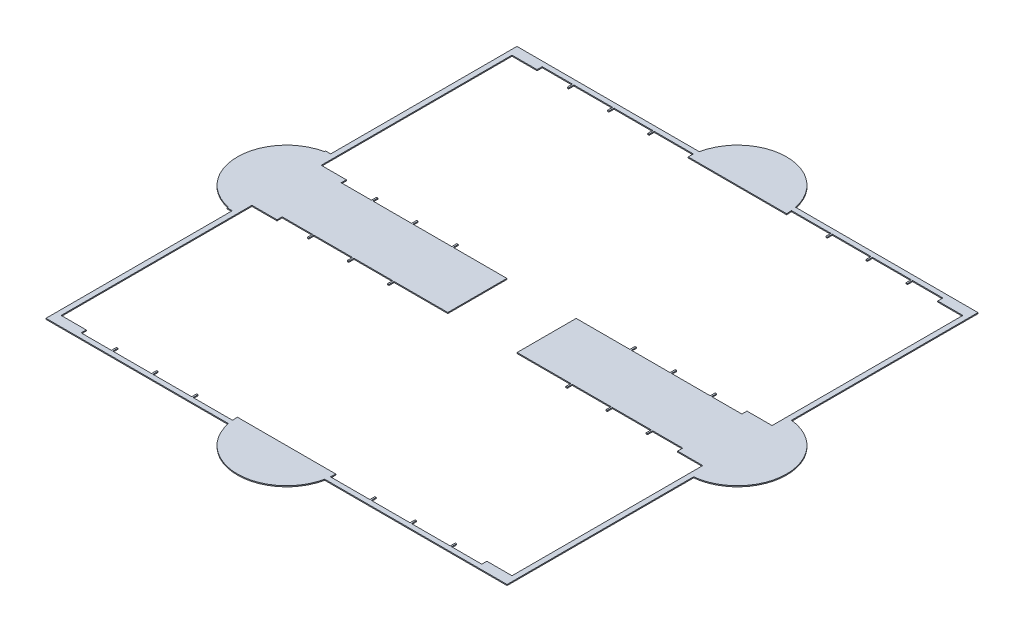
from build123d import *

# Parameters (mm, degrees)
SKETCH1_W           = 22.96
SKETCH1_H           = 22.96
SKETCH1_W_2         = 22.45
SKETCH1_H_2         = 22.45
SKETCH1_W_3         = 9.5
SKETCH1_H_3         = 0.255
SKETCH1_W_4         = 3.45
SKETCH1_H_4         = 3.45
SKETCH1_R           = 0.975
SKETCH1_W_5         = 0.25
SKETCH1_H_5         = 1
BOSS_EXTRUDE5_DEPTH = 0.05
SKETCH2_W           = 0.07
SKETCH2_H           = 0.5
CUT_EXTRUDE1_DEPTH  = 10
CUT_EXTRUDE3_START  = -10
SKETCH3_R           = 0.975
SKETCH3_W           = 0.561213406
SKETCH3_H           = 2.94
SKETCH3_W_2         = 2.113786594
SKETCH3_H_2         = 0.255
CUT_EXTRUDE3_DEPTH  = 10
BOSS_EXTRUDE7_DEPTH = 0.05


with BuildPart() as part:
    # Sketch1 → Boss-Extrude5 (new body)
    # profile 1 of 8: a face of its own
    with BuildSketch(Plane(origin=(0, 0, 0), x_dir=(1, 0, 0), z_dir=(0, 1, 0))):
        Rectangle(SKETCH1_W, SKETCH1_H)
        Rectangle(SKETCH1_W_2, SKETCH1_H_2, mode=Mode.SUBTRACT)
    # profile 2 of 8: a face of its own
    with BuildSketch(Plane(origin=(0, 0, 0), x_dir=(1, 0, 0), z_dir=(0, 1, 0))):
        with Locations((-6.475, -1.5975)):
            Rectangle(SKETCH1_W_3, SKETCH1_H_3)
    # profile 3 of 8: a face of its own
    with BuildSketch(Plane(origin=(0, 0, 0), x_dir=(1, 0, 0), z_dir=(0, 1, 0))):
        with Locations((-6.475, 1.5975)):
            Rectangle(SKETCH1_W_3, SKETCH1_H_3)
    # profile 4 of 8: a face of its own
    with BuildSketch(Plane(origin=(0, 0, 0), x_dir=(1, 0, 0), z_dir=(0, 1, 0))):
        Rectangle(SKETCH1_W_4, SKETCH1_H_4)
        with Locations(Location((0, 0, 0), (0, 0, 270))):
            Circle(SKETCH1_R, mode=Mode.SUBTRACT)
    # profile 5 of 8: a face of its own
    with BuildSketch(Plane(origin=(0, 0, 0), x_dir=(1, 0, 0), z_dir=(0, 1, 0))):
        with Locations((6.475, 1.5975)):
            Rectangle(SKETCH1_W_3, SKETCH1_H_3)
    # profile 6 of 8: a face of its own
    with BuildSketch(Plane(origin=(0, 0, 0), x_dir=(1, 0, 0), z_dir=(0, 1, 0))):
        with Locations((6.475, -1.5975)):
            Rectangle(SKETCH1_W_3, SKETCH1_H_3)
    # profile 7 of 8: a face of its own
    with BuildSketch(Plane(origin=(0, 0, 0), x_dir=(1, 0, 0), z_dir=(0, 1, 0))):
        with Locations((-11.605, -1.95)):
            Rectangle(SKETCH1_W_5, SKETCH1_H_5)
    # profile 8 of 8: a face of its own
    with BuildSketch(Plane(origin=(0, 0, 0), x_dir=(1, 0, 0), z_dir=(0, 1, 0))):
        with Locations((-11.605, 1.95)):
            Rectangle(SKETCH1_W_5, SKETCH1_H_5)
    extrude(amount=BOSS_EXTRUDE5_DEPTH)

    # Sketch2 → Cut-Extrude1 (cut)
    with BuildSketch(Plane(origin=(0, 0.05, 0), x_dir=(1, 0, 0), z_dir=(0, 1, 0))):
        with Locations((-6.435, 1.475)):
            Rectangle(SKETCH2_W, SKETCH2_H)
        with Locations((-8.435, 1.475)):
            Rectangle(SKETCH2_W, SKETCH2_H)
        with Locations((-4.435, 1.475)):
            Rectangle(SKETCH2_W, SKETCH2_H)
        with Locations((-4.435, 11.475)):
            Rectangle(SKETCH2_W, SKETCH2_H)
        with Locations((-6.435, 11.475)):
            Rectangle(SKETCH2_W, SKETCH2_H)
        with Locations((-8.435, 11.475)):
            Rectangle(SKETCH2_W, SKETCH2_H)
        with Locations((4.435, 1.475)):
            Rectangle(SKETCH2_W, SKETCH2_H)
        with Locations((6.435, 1.475)):
            Rectangle(SKETCH2_W, SKETCH2_H)
        with Locations((8.435, 1.475)):
            Rectangle(SKETCH2_W, SKETCH2_H)
        with Locations((4.435, 11.475)):
            Rectangle(SKETCH2_W, SKETCH2_H)
        with Locations((6.435, 11.475)):
            Rectangle(SKETCH2_W, SKETCH2_H)
        with Locations((8.435, 11.475)):
            Rectangle(SKETCH2_W, SKETCH2_H)
        with Locations((-8.435, -11.475)):
            Rectangle(SKETCH2_W, SKETCH2_H)
        with Locations((-6.435, -11.475)):
            Rectangle(SKETCH2_W, SKETCH2_H)
        with Locations((-4.435, -11.475)):
            Rectangle(SKETCH2_W, SKETCH2_H)
        with Locations((4.435, -11.475)):
            Rectangle(SKETCH2_W, SKETCH2_H)
        with Locations((6.435, -11.475)):
            Rectangle(SKETCH2_W, SKETCH2_H)
        with Locations((8.435, -11.475)):
            Rectangle(SKETCH2_W, SKETCH2_H)
        with Locations((8.435, -1.475)):
            Rectangle(SKETCH2_W, SKETCH2_H)
        with Locations((6.435, -1.475)):
            Rectangle(SKETCH2_W, SKETCH2_H)
        with Locations((4.435, -1.475)):
            Rectangle(SKETCH2_W, SKETCH2_H)
        with Locations((-4.435, -1.475)):
            Rectangle(SKETCH2_W, SKETCH2_H)
        with Locations((-6.435, -1.475)):
            Rectangle(SKETCH2_W, SKETCH2_H)
        with Locations((-8.435, -1.475)):
            Rectangle(SKETCH2_W, SKETCH2_H)
    extrude(amount=-CUT_EXTRUDE1_DEPTH, mode=Mode.SUBTRACT)

    # Sketch3 → Cut-Extrude3 (cut)
    # profile 1 of 9: a face of its own
    with BuildSketch(Plane(origin=(0, 0.05, 0), x_dir=(1, 0, 0), z_dir=(0, 1, 0)).offset(CUT_EXTRUDE3_START)):
        Polygon((-9.975, 11.48), (-9.975, -11.48), (-2.286213406, -11.48), (-2.286213406, -1.725), (-4.4, -1.725), (-4.4, -1.47), (-2.286213406, -1.47), (-2.286213406, 1.47), (-4.4, 1.47), (-4.4, 1.725), (-2.286213406, 1.725), (-2.286213406, 11.48), align=None)
    # profile 2 of 9: a face of its own
    with BuildSketch(Plane(origin=(0, 0.05, 0), x_dir=(1, 0, 0), z_dir=(0, 1, 0)).offset(CUT_EXTRUDE3_START)):
        Polygon((-2.286213406, -1.47), (-2.286213406, -1.725), (0, -1.725), (2.286213406, -1.725), (2.286213406, -1.47), (1.725, -1.47), (1.725, 1.47), (2.286213406, 1.47), (2.286213406, 1.725), (0, 1.725), (-2.286213406, 1.725), (-2.286213406, 1.47), (-1.725, 1.47), (-1.725, -1.47), align=None)
        Circle(SKETCH3_R, mode=Mode.SUBTRACT)
    # profile 3 of 9: a face of its own
    with BuildSketch(Plane(origin=(0, 0.05, 0), x_dir=(1, 0, 0), z_dir=(0, 1, 0)).offset(CUT_EXTRUDE3_START)):
        Polygon((2.286213406, -1.725), (2.286213406, -11.48), (9.975, -11.48), (9.975, 11.48), (2.286213406, 11.48), (2.286213406, 1.725), (4.4, 1.725), (4.4, 1.47), (2.286213406, 1.47), (2.286213406, -1.47), (4.4, -1.47), (4.4, -1.725), align=None)
    # profile 4 of 9: a face of its own
    with BuildSketch(Plane(origin=(0, 0.05, 0), x_dir=(1, 0, 0), z_dir=(0, 1, 0)).offset(CUT_EXTRUDE3_START)):
        with Locations((2.005606703, 0)):
            Rectangle(SKETCH3_W, SKETCH3_H)
    # profile 5 of 9: a face of its own
    with BuildSketch(Plane(origin=(0, 0.05, 0), x_dir=(1, 0, 0), z_dir=(0, 1, 0)).offset(CUT_EXTRUDE3_START)):
        with Locations((-2.005606703, 0)):
            Rectangle(SKETCH3_W, SKETCH3_H)
    # profile 6 of 9: a face of its own
    with BuildSketch(Plane(origin=(0, 0.05, 0), x_dir=(1, 0, 0), z_dir=(0, 1, 0)).offset(CUT_EXTRUDE3_START)):
        with Locations((-3.343106703, 1.5975)):
            Rectangle(SKETCH3_W_2, SKETCH3_H_2)
    # profile 7 of 9: a face of its own
    with BuildSketch(Plane(origin=(0, 0.05, 0), x_dir=(1, 0, 0), z_dir=(0, 1, 0)).offset(CUT_EXTRUDE3_START)):
        with Locations((-3.343106703, -1.5975)):
            Rectangle(SKETCH3_W_2, SKETCH3_H_2)
    # profile 8 of 9: a face of its own
    with BuildSketch(Plane(origin=(0, 0.05, 0), x_dir=(1, 0, 0), z_dir=(0, 1, 0)).offset(CUT_EXTRUDE3_START)):
        with Locations((3.343106703, 1.5975)):
            Rectangle(SKETCH3_W_2, SKETCH3_H_2)
    # profile 9 of 9: a face of its own
    with BuildSketch(Plane(origin=(0, 0.05, 0), x_dir=(1, 0, 0), z_dir=(0, 1, 0)).offset(CUT_EXTRUDE3_START)):
        with Locations((3.343106703, -1.5975)):
            Rectangle(SKETCH3_W_2, SKETCH3_H_2)
    extrude(amount=CUT_EXTRUDE3_DEPTH, mode=Mode.SUBTRACT)

    # Sketch5 → Boss-Extrude7 (add)
    with BuildSketch(Plane(origin=(0, 0.05, 0), x_dir=(1, 0, 0), z_dir=(0, 1, 0))):
        with BuildLine():
            Line((-11.225, 1.47), (-11.225, 2.45))
            ThreePointArc((-11.225, 2.45), (-13.675, 0), (-11.225, -2.45))
            Line((-11.225, -2.45), (-11.225, -1.47))
            Line((-11.225, -1.47), (-8.47, -1.47))
            Line((-8.47, -1.47), (-8.47, -1.725))
            Line((-8.47, -1.725), (-8.4, -1.725))
            Line((-8.4, -1.725), (-8.4, -1.47))
            Line((-8.4, -1.47), (-6.47, -1.47))
            Line((-6.47, -1.47), (-6.47, -1.725))
            Line((-6.47, -1.725), (-6.4, -1.725))
            Line((-6.4, -1.725), (-6.4, -1.47))
            Line((-6.4, -1.47), (-4.47, -1.47))
            Line((-4.47, -1.47), (-4.47, -1.725))
            Line((-4.47, -1.725), (-4.4, -1.725))
            Line((-4.4, -1.725), (-4.4, -1.47))
            Line((-4.4, -1.47), (-1.725, -1.47))
            Line((-1.725, -1.47), (-1.725, 1.47))
            Line((-1.725, 1.47), (-4.4, 1.47))
            Line((-4.4, 1.47), (-4.4, 1.725))
            Line((-4.4, 1.725), (-4.47, 1.725))
            Line((-4.47, 1.725), (-4.47, 1.47))
            Line((-4.47, 1.47), (-6.4, 1.47))
            Line((-6.4, 1.47), (-6.4, 1.725))
            Line((-6.4, 1.725), (-6.47, 1.725))
            Line((-6.47, 1.725), (-6.47, 1.47))
            Line((-6.47, 1.47), (-8.4, 1.47))
            Line((-8.4, 1.47), (-8.4, 1.725))
            Line((-8.4, 1.725), (-8.47, 1.725))
            Line((-8.47, 1.725), (-8.47, 1.47))
            Line((-8.47, 1.47), (-11.225, 1.47))
        make_face()
        with BuildLine():
            Line((-2.45, 11.225), (2.45, 11.225))
            ThreePointArc((2.45, 11.225), (2.446671103, 11.352673474), (2.436693456, 11.48))
            Line((2.436693456, 11.48), (4.4, 11.48))
            Line((4.4, 11.48), (4.4, 11.225))
            Line((4.4, 11.225), (4.47, 11.225))
            Line((4.47, 11.225), (4.47, 11.48))
            Line((4.47, 11.48), (6.4, 11.48))
            Line((6.4, 11.48), (6.4, 11.225))
            Line((6.4, 11.225), (6.47, 11.225))
            Line((6.47, 11.225), (6.47, 11.48))
            Line((6.47, 11.48), (8.4, 11.48))
            Line((8.4, 11.48), (8.4, 11.225))
            Line((8.4, 11.225), (8.47, 11.225))
            Line((8.47, 11.225), (8.47, 11.48))
            Line((8.47, 11.48), (11.48, 11.48))
            Line((11.48, 11.48), (11.48, 11.724852246))
            Line((11.48, 11.724852246), (2.398467788, 11.724852246))
            ThreePointArc((2.398467788, 11.724852246), (0, 13.675), (-2.398467788, 11.724852246))
            Line((-2.398467788, 11.724852246), (-11.48, 11.724852246))
            Line((-11.48, 11.724852246), (-11.48, 11.48))
            Line((-11.48, 11.48), (-8.47, 11.48))
            Line((-8.47, 11.48), (-8.47, 11.225))
            Line((-8.47, 11.225), (-8.4, 11.225))
            Line((-8.4, 11.225), (-8.4, 11.48))
            Line((-8.4, 11.48), (-6.47, 11.48))
            Line((-6.47, 11.48), (-6.47, 11.225))
            Line((-6.47, 11.225), (-6.4, 11.225))
            Line((-6.4, 11.225), (-6.4, 11.48))
            Line((-6.4, 11.48), (-4.47, 11.48))
            Line((-4.47, 11.48), (-4.47, 11.225))
            Line((-4.47, 11.225), (-4.4, 11.225))
            Line((-4.4, 11.225), (-4.4, 11.48))
            Line((-4.4, 11.48), (-2.436693456, 11.48))
            ThreePointArc((-2.436693456, 11.48), (-2.446671103, 11.352673474), (-2.45, 11.225))
        make_face()
        with BuildLine():
            Line((11.225, 2.45), (11.225, 1.47))
            Line((11.225, 1.47), (8.47, 1.47))
            Line((8.47, 1.47), (8.47, 1.725))
            Line((8.47, 1.725), (8.4, 1.725))
            Line((8.4, 1.725), (8.4, 1.47))
            Line((8.4, 1.47), (6.47, 1.47))
            Line((6.47, 1.47), (6.47, 1.725))
            Line((6.47, 1.725), (6.4, 1.725))
            Line((6.4, 1.725), (6.4, 1.47))
            Line((6.4, 1.47), (4.47, 1.47))
            Line((4.47, 1.47), (4.47, 1.725))
            Line((4.47, 1.725), (4.4, 1.725))
            Line((4.4, 1.725), (4.4, 1.47))
            Line((4.4, 1.47), (1.725, 1.47))
            Line((1.725, 1.47), (1.725, -1.47))
            Line((1.725, -1.47), (4.4, -1.47))
            Line((4.4, -1.47), (4.4, -1.725))
            Line((4.4, -1.725), (4.47, -1.725))
            Line((4.47, -1.725), (4.47, -1.47))
            Line((4.47, -1.47), (6.4, -1.47))
            Line((6.4, -1.47), (6.4, -1.725))
            Line((6.4, -1.725), (6.47, -1.725))
            Line((6.47, -1.725), (6.47, -1.47))
            Line((6.47, -1.47), (8.4, -1.47))
            Line((8.4, -1.47), (8.4, -1.725))
            Line((8.4, -1.725), (8.47, -1.725))
            Line((8.47, -1.725), (8.47, -1.47))
            Line((8.47, -1.47), (11.225, -1.47))
            Line((11.225, -1.47), (11.225, -2.45))
            ThreePointArc((11.225, -2.45), (13.675, 0), (11.225, 2.45))
        make_face()
        with BuildLine():
            Line((2.45, -11.225), (-2.45, -11.225))
            ThreePointArc((-2.45, -11.225), (-2.446671103, -11.352673474), (-2.436693456, -11.48))
            Line((-2.436693456, -11.48), (-4.4, -11.48))
            Line((-4.4, -11.48), (-4.4, -11.225))
            Line((-4.4, -11.225), (-4.47, -11.225))
            Line((-4.47, -11.225), (-4.47, -11.48))
            Line((-4.47, -11.48), (-6.4, -11.48))
            Line((-6.4, -11.48), (-6.4, -11.225))
            Line((-6.4, -11.225), (-6.47, -11.225))
            Line((-6.47, -11.225), (-6.47, -11.48))
            Line((-6.47, -11.48), (-8.4, -11.48))
            Line((-8.4, -11.48), (-8.4, -11.225))
            Line((-8.4, -11.225), (-8.47, -11.225))
            Line((-8.47, -11.225), (-8.47, -11.48))
            Line((-8.47, -11.48), (-11.48, -11.48))
            Line((-11.48, -11.48), (-11.48, -11.724852246))
            Line((-11.48, -11.724852246), (-2.398467788, -11.724852246))
            ThreePointArc((-2.398467788, -11.724852246), (0, -13.675), (2.398467788, -11.724852246))
            Line((2.398467788, -11.724852246), (11.48, -11.724852246))
            Line((11.48, -11.724852246), (11.48, -11.48))
            Line((11.48, -11.48), (8.47, -11.48))
            Line((8.47, -11.48), (8.47, -11.225))
            Line((8.47, -11.225), (8.4, -11.225))
            Line((8.4, -11.225), (8.4, -11.48))
            Line((8.4, -11.48), (6.47, -11.48))
            Line((6.47, -11.48), (6.47, -11.225))
            Line((6.47, -11.225), (6.4, -11.225))
            Line((6.4, -11.225), (6.4, -11.48))
            Line((6.4, -11.48), (4.47, -11.48))
            Line((4.47, -11.48), (4.47, -11.225))
            Line((4.47, -11.225), (4.4, -11.225))
            Line((4.4, -11.225), (4.4, -11.48))
            Line((4.4, -11.48), (2.436693456, -11.48))
            ThreePointArc((2.436693456, -11.48), (2.446671103, -11.352673474), (2.45, -11.225))
        make_face()
    extrude(amount=-BOSS_EXTRUDE7_DEPTH)


solid = part.part
